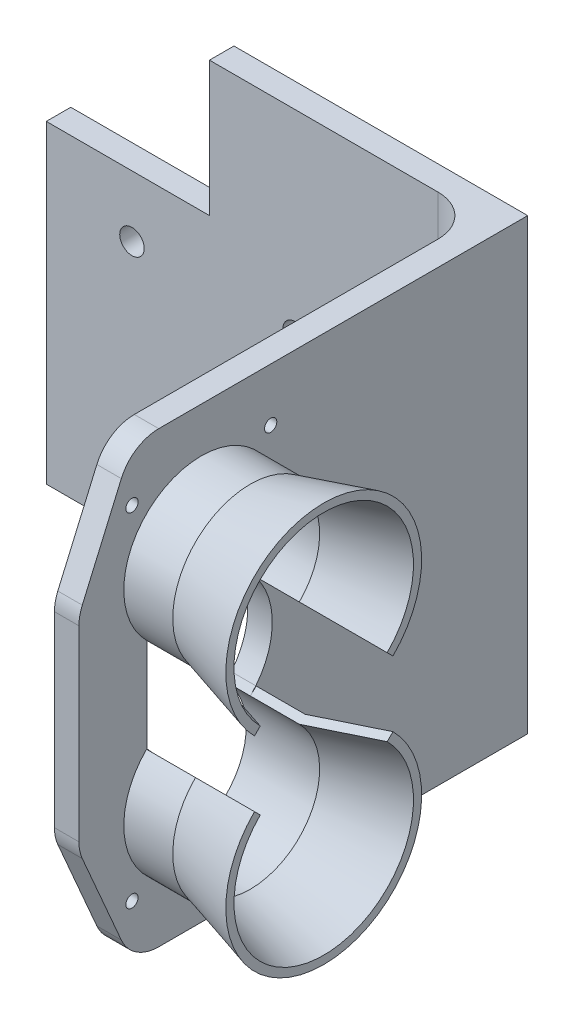
from build123d import *

# Parameters (mm, degrees)
EXTRUDE_1_DEPTH       = 27.5
SKETCH_3_R            = 0.75
CUT_EXTRUDE_3_DEPTH   = 3
REVOLVE_1_ANGLE       = 135
MIRROR_3_COPY_1_ANGLE = 135
MIRROR_3_COPY_2_ANGLE = 135
SKETCH_2_W            = 20
SKETCH_2_H            = 16.5
SKETCH_2_R            = 1.5
CUT_EXTRUDE_4_DEPTH   = 3
FILLET_1_R            = 5
FILLET_2_R            = 5


with BuildPart() as part:
    # 草图1 → 凸台-拉伸1 (new, symmetric)
    with BuildSketch(Plane(origin=(0, 0, 0), x_dir=(1, 0, 0), z_dir=(0, 1, 0))):
        Polygon((-30.117647059, 27.284313725), (25.882352941, 27.284313725), (25.882352941, -27.715686275), (22.882352941, -27.715686275), (22.882352941, 24.284313725), (-30.117647059, 24.284313725), align=None)
    extrude(amount=EXTRUDE_1_DEPTH, both=True)

    # 草图3 → 切除-拉伸3 (cut)
    with BuildSketch(Plane(origin=(25.882352941, 0, 0), x_dir=(0, 0, -1), z_dir=(1, 0, 0))):
        with BuildLine():
            Line((-12.715686275, 12.5), (-6.705278634, 6.48959236))
            ThreePointArc((-6.705278634, 6.48959236), (-4.862710248, 9.247190825), (-4.215686275, 12.5))
            ThreePointArc((-4.215686275, 12.5), (-6.705278634, 18.51040764), (-12.715686275, 21))
            Line((-12.715686275, 21), (-12.715686275, 12.5))
        make_face()
        with BuildLine():
            ThreePointArc((-12.715686275, 4), (-9.462877099, 4.647023974), (-6.705278634, 6.48959236))
            Line((-6.705278634, 6.48959236), (-12.715686275, 12.5))
            Line((-12.715686275, 12.5), (-12.715686275, 4))
        make_face()
        with BuildLine():
            Line((-12.715686275, 12.5), (-18.726093915, 6.48959236))
            ThreePointArc((-18.726093915, 6.48959236), (-15.96849545, 4.647023974), (-12.715686275, 4))
            Line((-12.715686275, 4), (-12.715686275, 12.5))
        make_face()
        with BuildLine():
            ThreePointArc((-12.715686275, 21), (-20.568662301, 15.752809175), (-18.726093915, 6.48959236))
            Line((-18.726093915, 6.48959236), (-12.715686275, 12.5))
            Line((-12.715686275, 12.5), (-12.715686275, 21))
        make_face()
        with BuildLine():
            Line((-12.715686275, 3), (-12.715686275, 0))
            Line((-12.715686275, 0), (-4.017201465, 0))
            ThreePointArc((-4.017201465, 0), (-4.536839235, 3.044356098), (-6.036908978, 5.743970558))
            ThreePointArc((-6.036908978, 5.743970558), (-9.105442495, 3.712728532), (-12.715686275, 3))
        make_face()
        with BuildLine():
            Line((-4.017201465, 0), (-12.715686275, 0))
            Line((-12.715686275, 0), (-12.715686275, -3))
            ThreePointArc((-12.715686275, -3), (-9.105442495, -3.712728532), (-6.036908978, -5.743970558))
            ThreePointArc((-6.036908978, -5.743970558), (-4.536839235, -3.044356098), (-4.017201465, 0))
        make_face()
        with BuildLine():
            Line((-19.394463571, 5.743970558), (-19.394463571, 0))
            Line((-19.394463571, 0), (-12.715686275, 0))
            Line((-12.715686275, 0), (-12.715686275, 3))
            ThreePointArc((-12.715686275, 3), (-16.325930054, 3.712728532), (-19.394463571, 5.743970558))
        make_face()
        with BuildLine():
            Line((-12.715686275, 0), (-19.394463571, 0))
            Line((-19.394463571, 0), (-19.394463571, -5.743970558))
            ThreePointArc((-19.394463571, -5.743970558), (-16.325930054, -3.712728532), (-12.715686275, -3))
            Line((-12.715686275, -3), (-12.715686275, 0))
        make_face()
        with BuildLine():
            Line((-6.705278634, -6.48959236), (-12.715686275, -12.5))
            Line((-12.715686275, -12.5), (-12.715686275, -21))
            ThreePointArc((-12.715686275, -21), (-6.705278634, -18.51040764), (-4.215686275, -12.5))
            ThreePointArc((-4.215686275, -12.5), (-4.862710248, -9.247190825), (-6.705278634, -6.48959236))
        make_face()
        with BuildLine():
            Line((-12.715686275, -4), (-12.715686275, -12.5))
            Line((-12.715686275, -12.5), (-6.705278634, -6.48959236))
            ThreePointArc((-6.705278634, -6.48959236), (-9.462877099, -4.647023974), (-12.715686275, -4))
        make_face()
        with BuildLine():
            ThreePointArc((-12.715686275, -4), (-15.96849545, -4.647023974), (-18.726093915, -6.48959236))
            Line((-18.726093915, -6.48959236), (-12.715686275, -12.5))
            Line((-12.715686275, -12.5), (-12.715686275, -4))
        make_face()
        with BuildLine():
            Line((-12.715686275, -12.5), (-18.726093915, -6.48959236))
            ThreePointArc((-18.726093915, -6.48959236), (-20.568662301, -15.752809175), (-12.715686275, -21))
            Line((-12.715686275, -21), (-12.715686275, -12.5))
        make_face()
        with Locations((-21.215686275, -21)):
            Circle(SKETCH_3_R)
        with Locations((-4.215686275, -21)):
            Circle(SKETCH_3_R)
        with Locations((-21.215686275, 21)):
            Circle(SKETCH_3_R)
        with Locations((-4.215686275, 21)):
            Circle(SKETCH_3_R)
        with BuildLine():
            ThreePointArc((-12.715686275, -3), (-16.325930054, -3.712728532), (-19.394463571, -5.743970558))
            Line((-19.394463571, -5.743970558), (-18.726093915, -6.48959236))
            ThreePointArc((-18.726093915, -6.48959236), (-15.96849545, -4.647023974), (-12.715686275, -4))
            ThreePointArc((-12.715686275, -4), (-9.462877099, -4.647023974), (-6.705278634, -6.48959236))
            Line((-6.705278634, -6.48959236), (-6.036908978, -5.743970558))
            ThreePointArc((-6.036908978, -5.743970558), (-9.105442495, -3.712728532), (-12.715686275, -3))
        make_face()
        with BuildLine():
            Line((-18.726093915, 6.48959236), (-19.394463571, 5.743970558))
            ThreePointArc((-19.394463571, 5.743970558), (-16.325930054, 3.712728532), (-12.715686275, 3))
            ThreePointArc((-12.715686275, 3), (-9.105442495, 3.712728532), (-6.036908978, 5.743970558))
            Line((-6.036908978, 5.743970558), (-6.705278634, 6.48959236))
            ThreePointArc((-6.705278634, 6.48959236), (-9.462877099, 4.647023974), (-12.715686275, 4))
            ThreePointArc((-12.715686275, 4), (-15.96849545, 4.647023974), (-18.726093915, 6.48959236))
        make_face()
        Polygon((-21.215686275, 27.5), (-23.783279652, 27.5), (-27.715686275, 27.5), (-27.715686275, 23.567593377), (-27.715686275, 20.249825378), (-27.715686275, 12.5), align=None)
        Polygon((-21.215686275, -27.5), (-27.715686275, -12.5), (-27.715686275, -20.249825378), (-27.715686275, -23.567593377), (-27.715686275, -27.5), (-23.783279652, -27.5), align=None)
    extrude(amount=-CUT_EXTRUDE_3_DEPTH, mode=Mode.SUBTRACT)

    # 草图5 → 旋转1 (revolve)
    with BuildSketch(Plane(origin=(0, 0, 12.715686275), x_dir=(0, -1, 0), z_dir=(0, 0, 1))):
        Polygon((-22, 25.882352941), (-21, 25.882352941), (-21, 31.882352941), (-23.5, 40.882352941), (-24.5, 40.882352941), (-22, 31.882352941), align=None)
    revolve_1 = revolve(axis=Axis((32.882352941, 12.5, 12.715686275), (-1, 0, 0)), revolution_arc=REVOLVE_1_ANGLE)

    # 镜向1: 旋转1 across plane
    add(revolve_1.mirror(Plane.ZX))

    # 镜向2: 旋转1 across plane
    add(revolve_1.mirror(Plane.XY.offset(12.715686275)))

    # 镜向3 copy 1 sketch → 镜向3 copy 1 (revolve)
    with BuildSketch(Plane.YX.offset(-12.715686275)):
        Polygon((-22, 25.882352941), (-21, 25.882352941), (-21, 31.882352941), (-23.5, 40.882352941), (-24.5, 40.882352941), (-22, 31.882352941), align=None)
    revolve(axis=Axis((32.882352941, -12.5, 12.715686275), (-1, 0, 0)), revolution_arc=MIRROR_3_COPY_1_ANGLE)

    # 镜向3 copy 2 sketch → 镜向3 copy 2 (revolve)
    with BuildSketch(Plane(origin=(0, 0, 12.715686275), x_dir=(0, -1, 0), z_dir=(0, 0, -1))):
        Polygon((-22, -25.882352941), (-21, -25.882352941), (-21, -31.882352941), (-23.5, -40.882352941), (-24.5, -40.882352941), (-22, -31.882352941), align=None)
    revolve(axis=Axis((32.882352941, 12.5, 12.715686275), (1, 0, 0)), revolution_arc=MIRROR_3_COPY_2_ANGLE)

    # 草图2 → 切除-拉伸4 (cut)
    with BuildSketch(Plane(origin=(0, 0, -27.284313725), x_dir=(-1, 0, 0), z_dir=(0, 0, -1))):
        with Locations((20.117647059, 19.25)):
            Rectangle(SKETCH_2_W, SKETCH_2_H)
        with Locations((-0.382352941, 3.5)):
            Circle(SKETCH_2_R)
        with Locations((19.617647059, 3.5)):
            Circle(SKETCH_2_R)
    extrude(amount=-CUT_EXTRUDE_4_DEPTH, mode=Mode.SUBTRACT)

    # 圆角1
    fillet_1_edges = [part.edges().sort_by_distance(p)[0] for p in [
        (22.882352941, 0, -24.284313725),
    ]]
    fillet(fillet_1_edges, radius=FILLET_1_R)

    # 圆角2
    fillet_2_edges = [part.edges().sort_by_distance(p)[0] for p in [
        (24.382352941, 12.5, 27.715686275),
        (24.382352941, 27.5, 21.215686275),
        (24.382352941, -12.5, 27.715686275),
        (24.382352941, -27.5, 21.215686275),
    ]]
    fillet(fillet_2_edges, radius=FILLET_2_R)


solid = part.part
